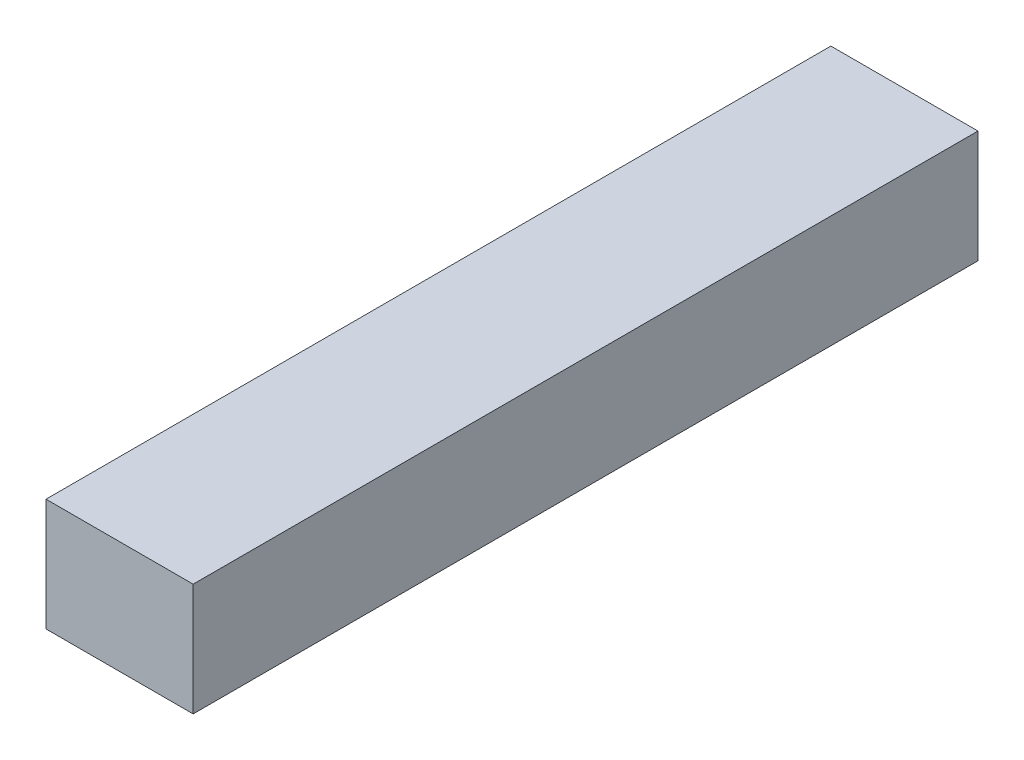
from build123d import *

# Parameters (mm, degrees)
SKETCH2_W           = 6
SKETCH2_H           = 4.583
BOSS_EXTRUDE1_DEPTH = 32


with BuildPart() as part:
    # Sketch2 → Boss-Extrude1 (new body)
    with BuildSketch(Plane.XY):
        with Locations((3, -2.2915)):
            Rectangle(SKETCH2_W, SKETCH2_H)
    extrude(amount=BOSS_EXTRUDE1_DEPTH)


solid = part.part
